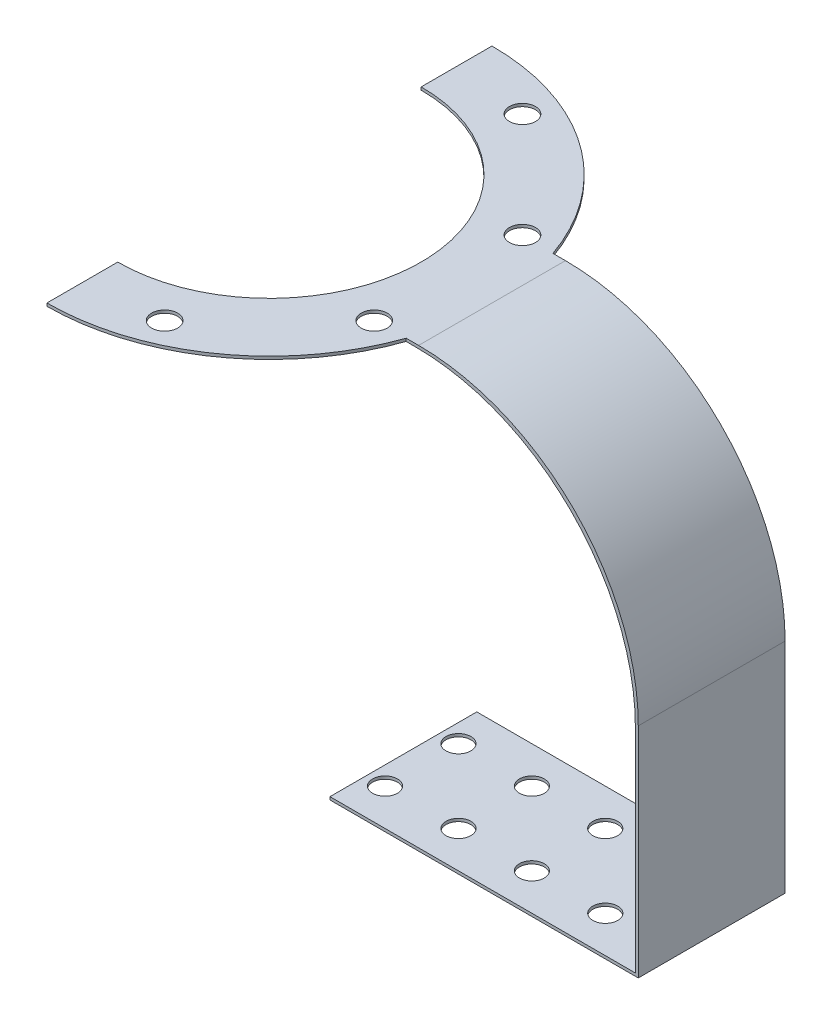
from build123d import *

# Parameters (mm, degrees)
BOSS_EXTRUDE1_DEPTH = 25.4
SKETCH3_R           = 2.15265
CUT_EXTRUDE1_DEPTH  = 0.5
SKETCH2_R           = 2.25
BOSS_EXTRUDE2_DEPTH = 0.5
CUT_EXTRUDE2_DEPTH  = 0.5
FILLET2_R           = 38


with BuildPart() as part:
    # Sketch1 → Boss-Extrude1 (new body)
    with BuildSketch(Plane.XY):
        Polygon((-0.5, 0.5), (-53.34, 0.5), (-53.34, 0), (0, 0), (0, 75.78), (-76.50978813, 75.78), (-76.50978813, 75.28), (-0.5, 75.28), align=None)
    extrude(amount=BOSS_EXTRUDE1_DEPTH)

    # Sketch3 → Cut-Extrude1 (cut)
    with BuildSketch(Plane(origin=(0, 0, 0), x_dir=(-1, 0, 0), z_dir=(0, -1, 0))):
        with Locations(Location((50.16, -19.05, 0), (0, 0, 90))):
            Circle(SKETCH3_R)
        with Locations(Location((37.46, -19.05, 0), (0, 0, 90))):
            Circle(SKETCH3_R)
        with Locations(Location((24.76, -19.05, 0), (0, 0, 90))):
            Circle(SKETCH3_R)
        with Locations(Location((12.06, -19.05, 0), (0, 0, 90))):
            Circle(SKETCH3_R)
        with Locations(Location((37.46, -6.35, 0), (0, 0, 90))):
            Circle(SKETCH3_R)
        with Locations(Location((24.76, -6.35, 0), (0, 0, 90))):
            Circle(SKETCH3_R)
        with Locations(Location((12.06, -6.35, 0), (0, 0, 90))):
            Circle(SKETCH3_R)
        with Locations(Location((50.16, -6.35, 0), (0, 0, 90))):
            Circle(SKETCH3_R)
    extrude(amount=-CUT_EXTRUDE1_DEPTH, mode=Mode.SUBTRACT)

    # Sketch2 → Boss-Extrude2 (add)
    with BuildSketch(Plane(origin=(0, 75.78, 0), x_dir=(1, 0, 0), z_dir=(0, 1, 0))):
        with BuildLine():
            ThreePointArc((-38.00978813, -12.7), (-49.286177054, 14.523611076), (-76.50978813, 25.8))
            Line((-76.50978813, 25.8), (-76.50978813, 13.55))
            ThreePointArc((-76.50978813, 13.55), (-57.948235124, 5.861553006), (-50.25978813, -12.7))
            ThreePointArc((-50.25978813, -12.7), (-57.948235124, -31.261553006), (-76.50978813, -38.95))
            Line((-76.50978813, -38.95), (-76.50978813, -51.2))
            ThreePointArc((-76.50978813, -51.2), (-49.286177054, -39.923611076), (-38.00978813, -12.7))
        make_face()
        with Locations(Location((-63.689893146, -43.649964339, 0), (0, 0, 270))):
            Circle(SKETCH2_R, mode=Mode.SUBTRACT)
        with Locations((-45.559823791, -25.519894984)):
            Circle(SKETCH2_R, mode=Mode.SUBTRACT)
        with Locations((-45.559823791, 0.119894984)):
            Circle(SKETCH2_R, mode=Mode.SUBTRACT)
        with Locations(Location((-63.689893146, 18.249964339, 0), (0, 0, 270))):
            Circle(SKETCH2_R, mode=Mode.SUBTRACT)
    extrude(amount=-BOSS_EXTRUDE2_DEPTH)

    # Sketch2<3> → Cut-Extrude2 (cut)
    with BuildSketch(Plane(origin=(0, 75.78, 0), x_dir=(1, 0, 0), z_dir=(0, 1, 0))):
        with BuildLine():
            Line((-43.313020463, -25.4), (-47.806627118, -25.4))
            ThreePointArc((-47.806627118, -25.4), (-45.619792587, -27.769095674), (-43.309823791, -25.519894984))
            ThreePointArc((-43.309823791, -25.519894984), (-43.310623101, -25.459926188), (-43.313020463, -25.4))
        make_face()
        with BuildLine():
            ThreePointArc((-43.313020463, -25.4), (-45.559823791, -23.269894984), (-47.806627118, -25.4))
            Line((-47.806627118, -25.4), (-43.313020463, -25.4))
        make_face()
        with BuildLine():
            Line((-43.313020463, 0), (-47.806627118, 0))
            ThreePointArc((-47.806627118, 0), (-45.559823791, -2.130105016), (-43.313020463, 0))
        make_face()
        with BuildLine():
            ThreePointArc((-43.309823791, 0.119894984), (-45.619792587, 2.369095674), (-47.806627118, 0))
            Line((-47.806627118, 0), (-43.313020463, 0))
            ThreePointArc((-43.313020463, 0), (-43.310623101, 0.059926188), (-43.309823791, 0.119894984))
        make_face()
        with BuildLine():
            Line((-71.249275888, 0), (-76.50978813, -12.7))
            Line((-76.50978813, -12.7), (-76.50978813, -25.4))
            Line((-76.50978813, -25.4), (-53.536488411, -25.4))
            ThreePointArc((-53.536488411, -25.4), (-51.092160215, -19.257948702), (-50.25978813, -12.7))
            ThreePointArc((-50.25978813, -12.7), (-51.092160215, -6.142051298), (-53.536488411, 0))
            Line((-53.536488411, 0), (-71.249275888, 0))
        make_face()
        Polygon((-76.50978813, 0), (-76.50978813, -12.7), (-71.249275888, 0), align=None)
    extrude(amount=-CUT_EXTRUDE2_DEPTH, mode=Mode.SUBTRACT)

    # Fillet2
    fillet2_edges = [part.edges().sort_by_distance(p)[0] for p in [
        (-0.5, 75.28, 12.7),
        (0, 75.78, 12.7),
    ]]
    fillet(fillet2_edges, radius=FILLET2_R)


solid = part.part
